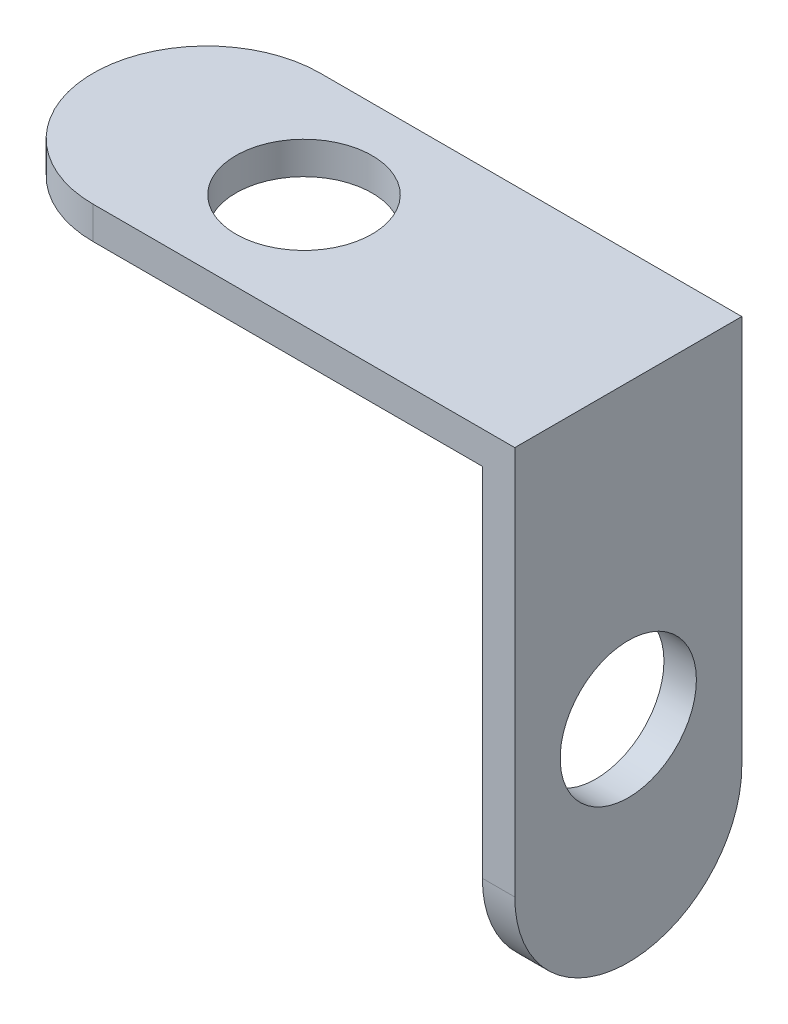
from build123d import *

# Parameters (mm, degrees)
SKETCH_1_R      = 2.1
EXTRUDE_1_DEPTH = 1
SKETCH_2_R      = 2.1
EXTRUDE_2_DEPTH = 1
SCALE_2_SCALE   = 0.5
SCALE_1_SCALE   = 0.5
SCALE_3_SCALE   = 2


with BuildPart() as part:
    # Эскиз1 → Бобышка-Вытянуть1 (new body)
    with BuildSketch(Plane(origin=(0, 0, 0), x_dir=(1, 0, 0), z_dir=(0, 1, 0))):
        with BuildLine():
            Line((0, -7), (-7, -7))
            ThreePointArc((-7, -7), (-10.5, -3.5), (-7, 0))
            Line((-7, 0), (0, 0))
            Line((0, 0), (5, 0))
            Line((5, 0), (5, -7))
            Line((5, -7), (0, -7))
        make_face()
        with Locations(Location((-4, -3.5, 0), (0, 0, 270))):
            Circle(SKETCH_1_R, mode=Mode.SUBTRACT)
    extrude(amount=EXTRUDE_1_DEPTH)

    # Эскиз2 → Бобышка-Вытянуть2 (add)
    with BuildSketch(Plane(origin=(5, 0, 0), x_dir=(0, 0, -1), z_dir=(1, 0, 0))):
        with BuildLine():
            Line((0, -11), (0, 1))
            Line((0, 1), (-7, 1))
            Line((-7, 1), (-7, -11))
            ThreePointArc((-7, -11), (-3.5, -14.5), (0, -11))
        make_face()
        with Locations((-3.5, -8)):
            Circle(SKETCH_2_R, mode=Mode.SUBTRACT)
    extrude(amount=EXTRUDE_2_DEPTH)


with BuildPart() as part_1:
    # Масштаб2: scaled about (1.676803453, -2.823196547, 3.5)
    add(part.part.scale(SCALE_2_SCALE).moved(Location((0.838401726, -1.411598273, 1.75))))


with BuildPart() as part_2:
    # Масштаб1: scaled about (1.676803453, -2.823196547, 3.5)
    add(part_1.part.scale(SCALE_1_SCALE).moved(Location((0.838401726, -1.411598273, 1.75))))


with BuildPart() as part_3:
    # Масштаб3: scaled about (1.676803453, -2.823196547, 3.5)
    add(part_2.part.scale(SCALE_3_SCALE).moved(Location((-1.676803453, 2.823196547, -3.5))))


solid = part_3.part
